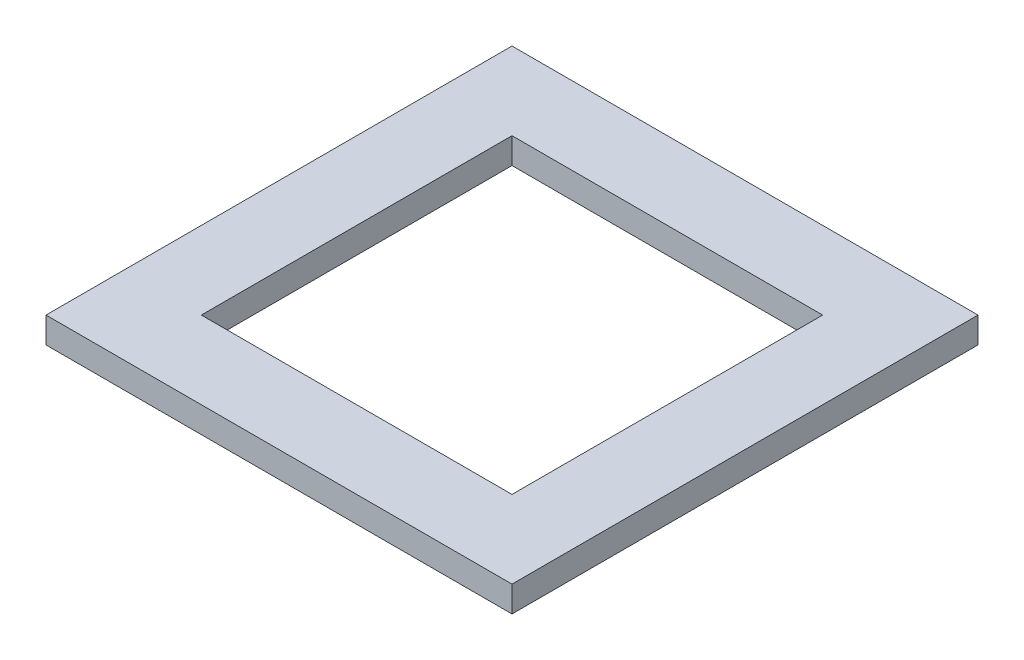
from build123d import *

# Parameters (mm, degrees)
SKETCH2_W           = 90
SKETCH2_H           = 90
SKETCH2_W_2         = 60
SKETCH2_H_2         = 60
BOSS_EXTRUDE1_DEPTH = 5


with BuildPart() as part:
    # Sketch2 → Boss-Extrude1 (new body)
    with BuildSketch(Plane(origin=(0, 0, 0), x_dir=(1, 0, 0), z_dir=(0, 1, 0))):
        Rectangle(SKETCH2_W, SKETCH2_H)
        Rectangle(SKETCH2_W_2, SKETCH2_H_2, mode=Mode.SUBTRACT)
    extrude(amount=BOSS_EXTRUDE1_DEPTH)


solid = part.part
